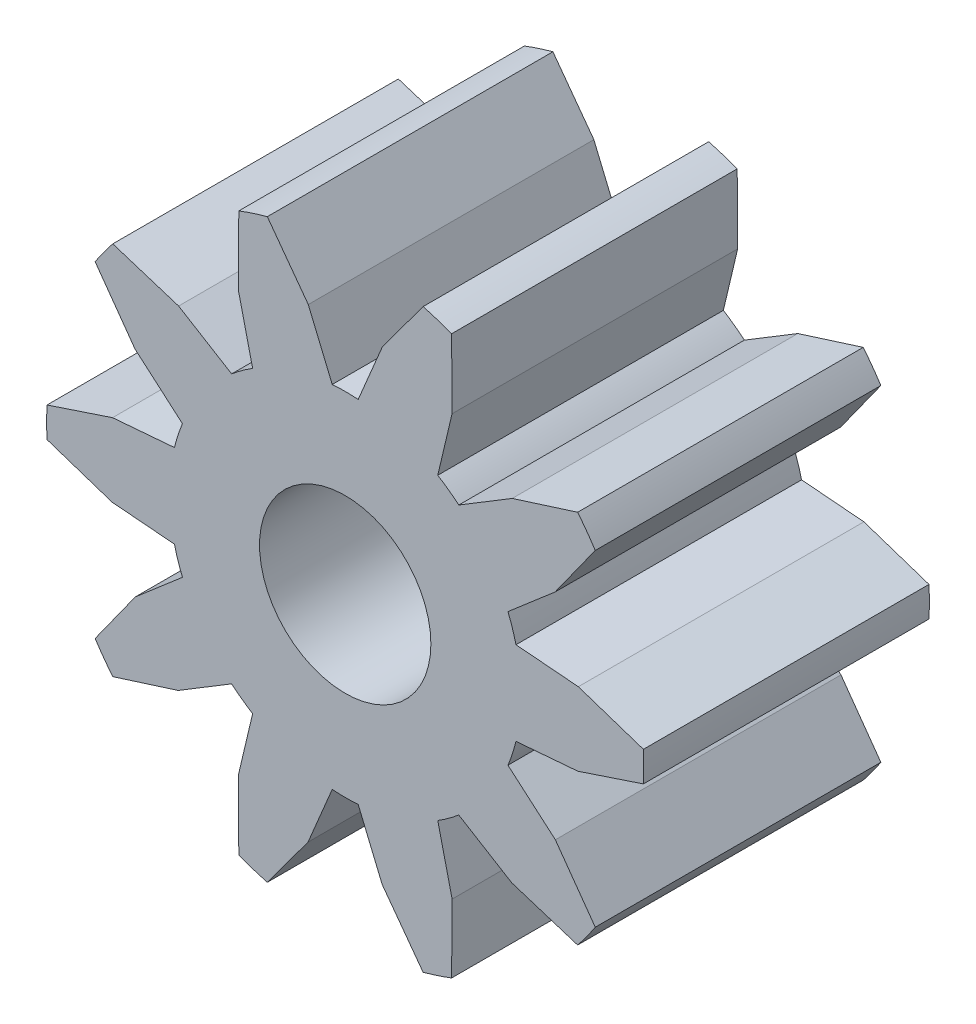
from build123d import *

# Parameters (mm, degrees)
SKETCH1_R           = 5.75
BOSS_EXTRUDE1_DEPTH = 5.5
SKETCH2_R           = 1.65
CUT_EXTRUDE1_DEPTH  = 5.5
CUT_EXTRUDE3_START  = -5.5
CUT_EXTRUDE3_DEPTH  = 5.5
CIRPATTERN2_COUNT   = 10


with BuildPart() as part:
    # Sketch1 → Boss-Extrude1 (new body)
    with BuildSketch(Plane.XY):
        Circle(SKETCH1_R)
    extrude(amount=BOSS_EXTRUDE1_DEPTH)

    # Sketch2 → Cut-Extrude1 (cut)
    with BuildSketch(Plane.XY.offset(5.5)):
        Circle(SKETCH2_R)
    extrude(amount=-CUT_EXTRUDE1_DEPTH, mode=Mode.SUBTRACT)

    # Sketch5 → Cut-Extrude3 (cut)
    with BuildSketch(Plane.XY.offset(5.5).offset(CUT_EXTRUDE3_START)):
        with BuildLine():
            Line((-0.25, 3.376770386), (-0.711246658, 4.479961461))
            Line((-0.711246658, 4.479961461), (-1.5, 5.550900828))
            ThreePointArc((-1.5, 5.550900828), (0, 5.75), (1.5, 5.550900828))
            Line((1.5, 5.550900828), (0.715828266, 4.487930272))
            Line((0.715828266, 4.487930272), (0.25, 3.376770386))
            ThreePointArc((0.25, 3.376770386), (0, 3.386012144), (-0.25, 3.376770386))
        make_face()
    cut_extrude3 = extrude(amount=CUT_EXTRUDE3_DEPTH, mode=Mode.SUBTRACT)

    # CirPattern2: Cut-Extrude3 ×10 about axis
    cirpattern2_axis = Axis((0, 0, 0), (0, 0, 1))
    for i in range(1, CIRPATTERN2_COUNT):
        add(cut_extrude3.rotate(cirpattern2_axis, i * 360 / CIRPATTERN2_COUNT), mode=Mode.SUBTRACT)


solid = part.part
